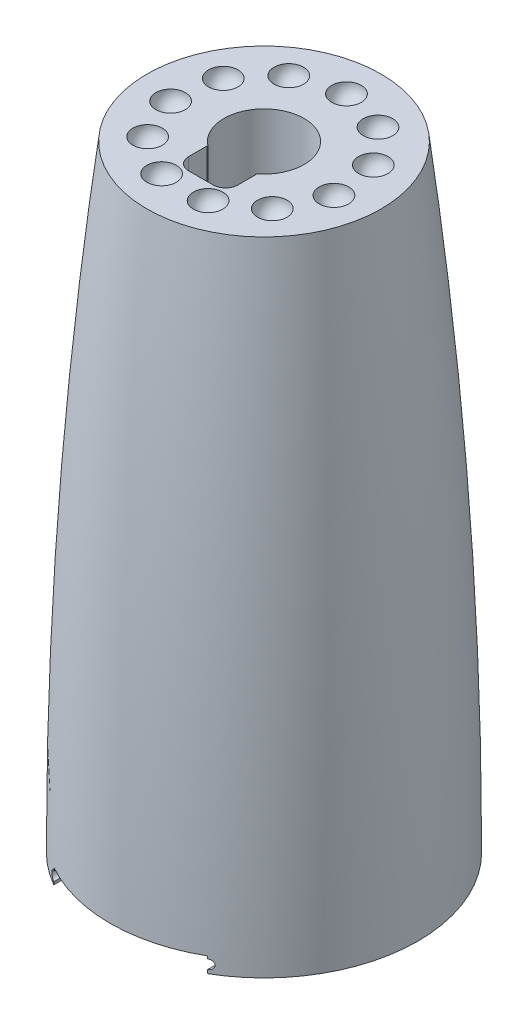
from build123d import *

# Parameters (mm, degrees)
MATRIZC1_COUNT        = 11
CROQUIS4_W            = 50
CROQUIS4_H            = 50
CORTAR_EXTRUIR1_DEPTH = 100
CORTAR_EXTRUIR2_REACH = 272.416
CORTAR_EXTRUIR3_REACH = 214.132


with BuildPart() as part:
    # Croquis2 → Revolución1 (revolve)
    with BuildSketch(Plane.XY, mode=Mode.PRIVATE) as revoluci_n1_sk:
        with BuildLine():
            Line((-13, 140), (-13, 200))
            Line((-13, 200), (-38, 200))
            ThreePointArc((-38, 200), (-46.997304849, 100.179838291), (-50, 0))
            Line((-50, 0), (0, 0))
            Line((0, 0), (0, 140))
            Line((0, 140), (-13, 140))
        make_face()
    revolve(revoluci_n1_sk.sketch.rotate(Axis((0, 0, 0), (0, 1, 0)), 270), axis=Axis((0, 0, 0), (0, 1, 0)))

    # Croquis3 → Cortar-Revolución1 (revolve, cut)
    with BuildSketch(Plane(origin=(0, 200, 0), x_dir=(1, 0, 0), z_dir=(0, 1, 0))):
        with BuildLine():
            Line((0, 31.6), (0, 22))
            ThreePointArc((0, 22), (4.8, 26.8), (0, 31.6))
        make_face()
    cortar_revoluci_n1 = revolve(axis=Axis((0, 200, -31.6), (0, 0, 1)), mode=Mode.SUBTRACT)

    # MatrizC1: Cortar-Revolución1 ×11 about axis
    matrizc1_axis = Axis((0, 0, 0), (0, 1, 0))
    for i in range(1, MATRIZC1_COUNT):
        add(cortar_revoluci_n1.rotate(matrizc1_axis, i * 360 / MATRIZC1_COUNT), mode=Mode.SUBTRACT)

    # Croquis4 → Cortar-Extruir1 (cut)
    with BuildSketch(Plane.XZ):
        Rectangle(CROQUIS4_W, CROQUIS4_H)
    extrude(amount=-CORTAR_EXTRUIR1_DEPTH, mode=Mode.SUBTRACT)

    # Cortar-Extruir2: up to this face of the body (flat: up to its plane)
    cortar_extruir2_end = Plane(part.part.faces().sort_by_distance((0, 50, -25))[0])
    # Croquis5 → Cortar-Extruir2 (cut, up to the picked face)
    with BuildSketch(Plane.XY.offset(125), mode=Mode.PRIVATE) as cortar_extruir2_sk1:
        with BuildLine():
            Line((25, 0), (25, 1.166817967))
            ThreePointArc((25, 1.166817967), (26.5, 2.666817967), (25, 4.166817967))
            Line((25, 4.166817967), (25, 5))
            Line((25, 5), (-25, 5))
            Line((-25, 5), (-25, 3.859256745))
            ThreePointArc((-25, 3.859256745), (-26.5, 2.359256745), (-25, 0.859256745))
            Line((-25, 0.859256745), (-25, 0))
            Line((-25, 0), (25, 0))
        make_face()
    cortar_extruir2_tool1 = split(extrude(cortar_extruir2_sk1.sketch, amount=-CORTAR_EXTRUIR2_REACH, mode=Mode.PRIVATE), bisect_by=cortar_extruir2_end, keep=Keep.BOTH, mode=Mode.PRIVATE)
    add(cortar_extruir2_tool1.solids().sort_by(Axis((0, 2.500358, 125), (0, 0, -1)))[0], mode=Mode.SUBTRACT)

    # Cortar-Extruir3: up to this face of the body (flat: up to its plane)
    cortar_extruir3_end = Plane(part.part.faces().sort_by_distance((0, 100, 0))[0])
    # Croquis6 → Cortar-Extruir3 (cut, up to the picked face)
    with BuildSketch(Plane(origin=(0, 200, 0), x_dir=(1, 0, 0), z_dir=(0, 1, 0)), mode=Mode.PRIVATE) as cortar_extruir3_sk1:
        with BuildLine():
            Line((8, -10.5), (-8, -10.5))
            Line((-8, -10.5), (-8, -16.5))
            ThreePointArc((-8, -16.5), (-6.828427125, -19.328427125), (-4, -20.5))
            Line((-4, -20.5), (4, -20.5))
            ThreePointArc((4, -20.5), (6.828427125, -19.328427125), (8, -16.5))
            Line((8, -16.5), (8, -10.5))
        make_face()
    cortar_extruir3_tool1 = split(extrude(cortar_extruir3_sk1.sketch, amount=-CORTAR_EXTRUIR3_REACH, mode=Mode.PRIVATE), bisect_by=cortar_extruir3_end, keep=Keep.BOTH, mode=Mode.PRIVATE)
    add(cortar_extruir3_tool1.solids().sort_by(Axis((0, 200, 15.315842), (0, -1, 0)))[0], mode=Mode.SUBTRACT)


solid = part.part
